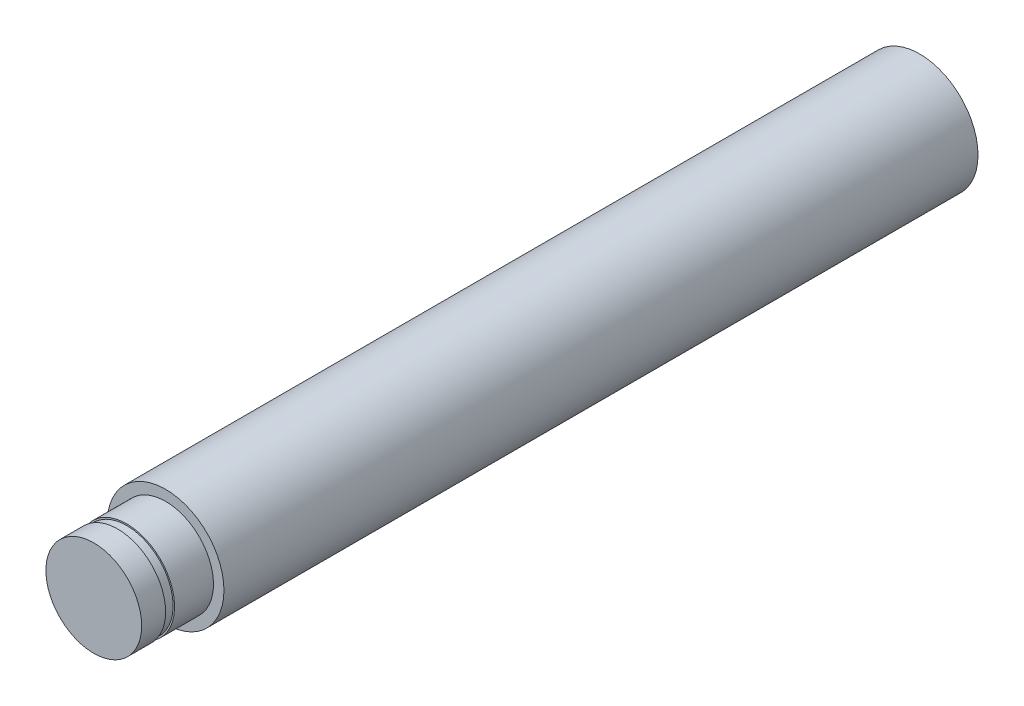
from build123d import *

# Parameters (mm, degrees)
SKETCH1_R           = 2.4765
BOSS_EXTRUDE1_DEPTH = 32.004
SKETCH2_R           = 2.032
BOSS_EXTRUDE2_DEPTH = 1.651
SKETCH3_R           = 1.9685
BOSS_EXTRUDE3_DEPTH = 0.381
SKETCH4_R           = 2.032
BOSS_EXTRUDE4_DEPTH = 1.016


with BuildPart() as part:
    # Sketch1 → Boss-Extrude1 (new body)
    with BuildSketch(Plane.XY):
        Circle(SKETCH1_R)
    extrude(amount=BOSS_EXTRUDE1_DEPTH)

    # Sketch2 → Boss-Extrude2 (add)
    with BuildSketch(Plane.XY.offset(32.004)):
        with Locations(Location((0, 0, 0), (0, 0, 180))):
            Circle(SKETCH2_R)
    extrude(amount=BOSS_EXTRUDE2_DEPTH)

    # Sketch3 → Boss-Extrude3 (add)
    with BuildSketch(Plane.XY.offset(33.655)):
        with Locations(Location((0, 0, 0), (0, 0, 180))):
            Circle(SKETCH3_R)
    extrude(amount=BOSS_EXTRUDE3_DEPTH)

    # Sketch4 → Boss-Extrude4 (add)
    with BuildSketch(Plane.XY.offset(34.036)):
        with Locations(Location((0, 0, 0), (0, 0, 180))):
            Circle(SKETCH4_R)
    extrude(amount=BOSS_EXTRUDE4_DEPTH)


solid = part.part
